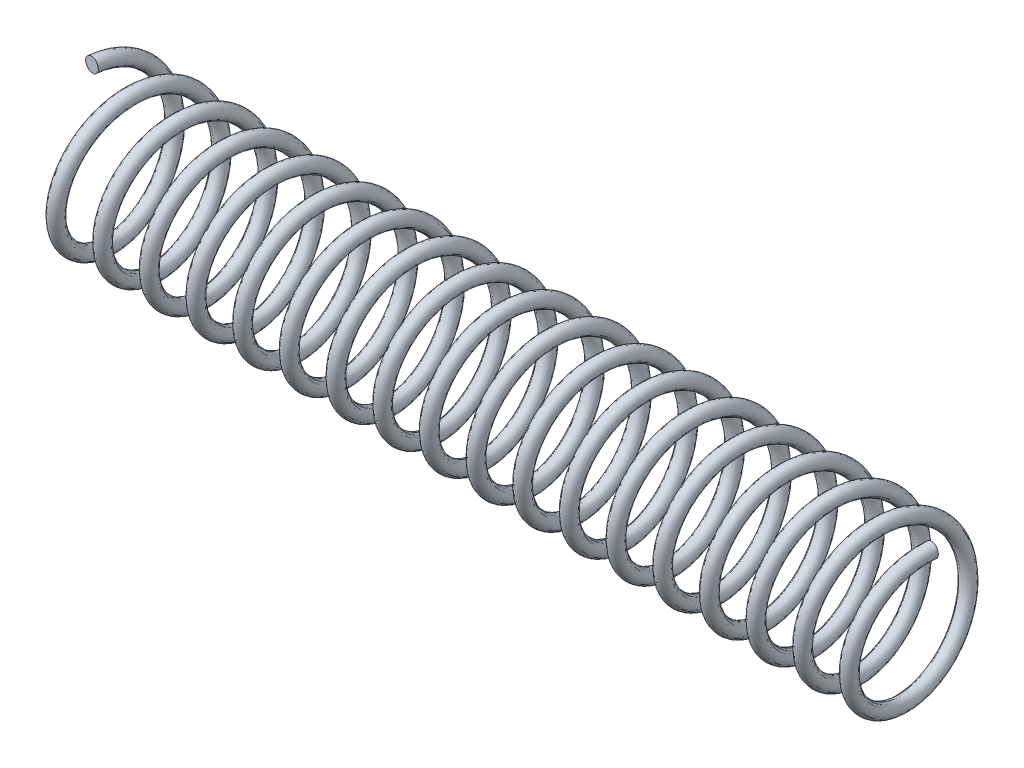
from build123d import *

# Parameters (mm, degrees)
SWEEP1_PITCH       = 3.3
SWEEP1_HEIGHT      = 59.4
SWEEP1_RADIUS      = 5
SWEEP1_START_ANGLE = -90
SWEEP1_PROFILE_R   = 0.5


with BuildPart() as part:
    # Sweep1: sweep along a helix
    with BuildLine() as sweep1_path:
        add(Helix(SWEEP1_PITCH, SWEEP1_HEIGHT, SWEEP1_RADIUS, center=(0, 0, 0), direction=(1, 0, 0), lefthand=True, mode=Mode.PRIVATE).rotate(Axis((0, 0, 0), (1, 0, 0)), SWEEP1_START_ANGLE))
    # Sweep1 profile (on start of the path) → Sweep1 (sweep)
    with BuildSketch(Plane(origin=(0, 5, 0), x_dir=(-0.9945283006862982, 0, -0.10446750276532958), z_dir=(0.10446750276532958, 1.6635504848222516e-13, -0.9945283006862982))):
        Circle(SWEEP1_PROFILE_R)
    sweep(path=sweep1_path.line, is_frenet=True)


solid = part.part
